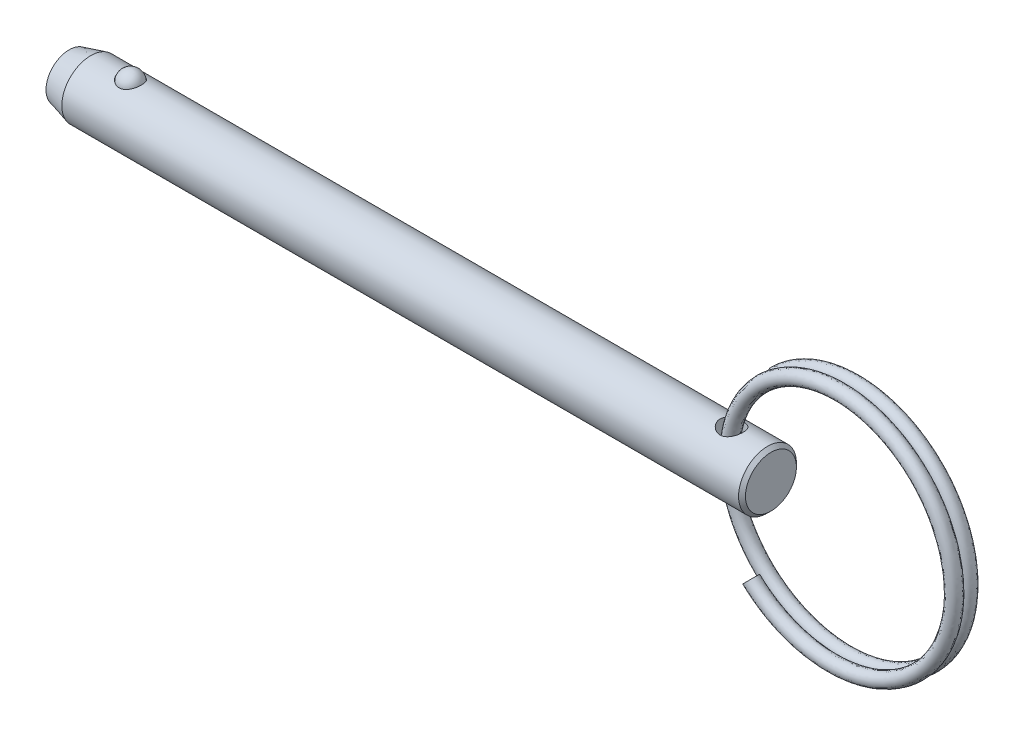
from build123d import *

# Parameters (mm, degrees)
SKETCH4_W          = 1.27
SKETCH4_H          = 6.35
SWEEP1_PITCH       = 1.5494
SWEEP1_HEIGHT      = 1.355725
SWEEP1_RADIUS      = 13.462
SKETCH6_R          = 0.762
SWEEP2_PITCH       = 1.5494
SWEEP2_HEIGHT      = 1.355725
SWEEP2_RADIUS      = 13.462
SWEEP2_START_ANGLE = -180
SKETCH6_2_R        = 0.762


with BuildPart() as part:
    # Sketch1 → Revolve1 (revolve)
    with BuildSketch(Plane.XY, mode=Mode.PRIVATE) as revolve1_sk:
        Polygon((38.5064, 2.794), (38.1254, 3.175), (-36.136547737, 3.175), (-38.5064, 2.54), (-38.5064, 0), (38.5064, 0), align=None)
    revolve(revolve1_sk.sketch.rotate(Axis((38.5064, 0, 0), (1, 0, 0)), 90), axis=Axis((38.5064, 0, 0), (1, 0, 0)))

    # Sketch2 → Cut-Revolve1 (revolve, cut)
    with BuildSketch(Plane.XY):
        with BuildLine():
            Line((-30.514582051, 2.8575), (-33.029182051, 2.8575))
            ThreePointArc((-33.029182051, 2.8575), (-31.771882051, 4.1148), (-30.514582051, 2.8575))
        make_face()
    revolve(axis=Axis((-30.514582051, 2.8575, 0), (1, 0, 0)), mode=Mode.SUBTRACT)

    # Sketch4 → Cut-Revolve2 (revolve, cut)
    with BuildSketch(Plane.XY, mode=Mode.PRIVATE) as cut_revolve2_sk:
        with Locations((34.8234, 0)):
            Rectangle(SKETCH4_W, SKETCH4_H)
    revolve(cut_revolve2_sk.sketch.rotate(Axis((34.1884, -3.175, 0), (0, 1, 0)), 90), axis=Axis((34.1884, -3.175, 0), (0, 1, 0)), mode=Mode.SUBTRACT)


with BuildPart() as body_2:
    # Sketch3 → Revolve2 (revolve)
    with BuildSketch(Plane.XY):
        with BuildLine():
            Line((-30.539982051, 2.8575), (-33.003782051, 2.8575))
            ThreePointArc((-33.003782051, 2.8575), (-31.771882051, 4.0894), (-30.539982051, 2.8575))
        make_face()
    revolve(axis=Axis((-30.539982051, 2.8575, 0), (1, 0, 0)))


with BuildPart() as body_3:
    # Sweep1: sweep along a helix
    with BuildLine() as sweep1_path:
        Helix(SWEEP1_PITCH, SWEEP1_HEIGHT, SWEEP1_RADIUS, center=(46.673425091, 0, 0), direction=(0, 0, -1), lefthand=True)
    # Sketch6 → Sweep1 (sweep)
    with BuildSketch(Plane(origin=(114.003847968, 0, 0), x_dir=(0, 0, -1), z_dir=(0, 1, 0))):
        with Locations((0, 80.030422877)):
            Circle(SKETCH6_R)
    sweep(path=sweep1_path.line, is_frenet=True)

    # Sweep2: sweep along a helix
    with BuildLine() as sweep2_path:
        add(Helix(SWEEP2_PITCH, SWEEP2_HEIGHT, SWEEP2_RADIUS, center=(46.673425091, 0, 0), direction=(0, 0, 1), lefthand=True, mode=Mode.PRIVATE).rotate(Axis((46.673425091, 0, 0), (0, 0, 1)), SWEEP2_START_ANGLE))
    # Sketch6<2> → Sweep2 (sweep)
    with BuildSketch(Plane(origin=(114.003847968, 0, 0), x_dir=(0, 0, -1), z_dir=(0, 1, 0))):
        with Locations((0, 80.030422877)):
            Circle(SKETCH6_2_R)
    sweep(path=sweep2_path.line, is_frenet=True)


solid = Compound([part.part, body_2.part, body_3.part])
